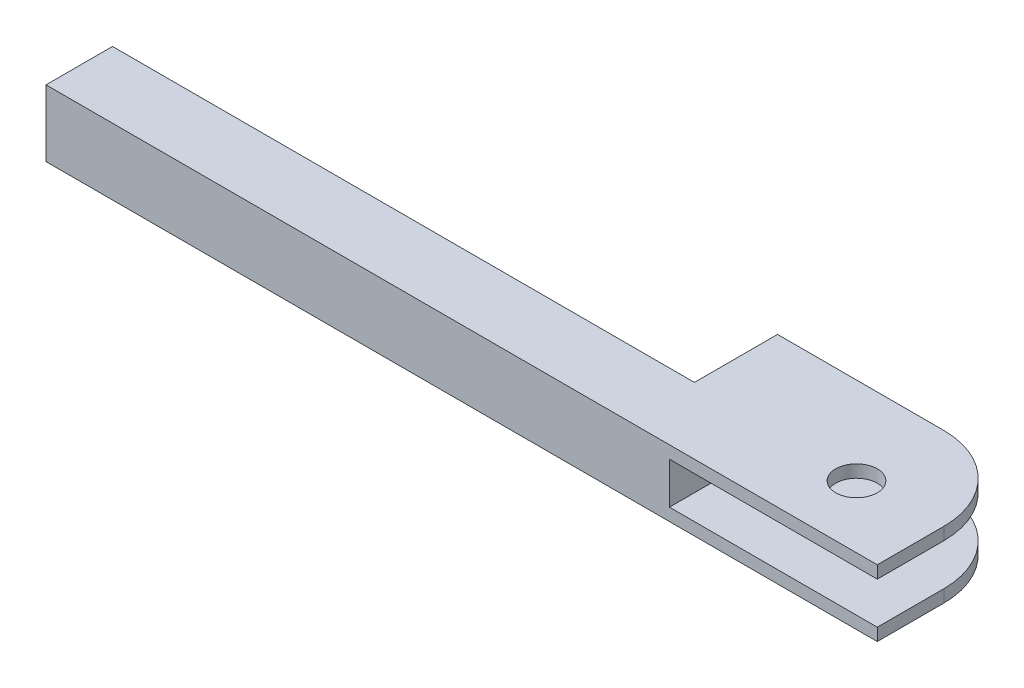
from build123d import *

# Parameters (mm, degrees)
BOSS_EXTRUDE1_DEPTH = 8
SKETCH2_W           = 25
SKETCH2_H           = 5
CUT_EXTRUDE1_DEPTH  = 35
SKETCH3_R           = 2.5
CUT_EXTRUDE2_DEPTH  = 35
FILLET1_R           = 10


with BuildPart() as part:
    # Sketch1 → Boss-Extrude1 (new body)
    with BuildSketch(Plane(origin=(0, 0, 0), x_dir=(1, 0, 0), z_dir=(0, 1, 0))):
        Polygon((0, 0), (0, 8), (70, 8), (70, 18), (100, 18), (100, 0), align=None)
    extrude(amount=BOSS_EXTRUDE1_DEPTH)

    # Sketch2 → Cut-Extrude1 (cut)
    with BuildSketch(Plane.XY):
        with Locations((87.5, 4)):
            Rectangle(SKETCH2_W, SKETCH2_H)
    extrude(amount=-CUT_EXTRUDE1_DEPTH, mode=Mode.SUBTRACT)

    # Sketch3 → Cut-Extrude2 (cut)
    with BuildSketch(Plane(origin=(0, 8, 0), x_dir=(1, 0, 0), z_dir=(0, 1, 0))):
        with Locations(Location((90, 7.5, 0), (0, 0, 270))):
            Circle(SKETCH3_R)
    extrude(amount=-CUT_EXTRUDE2_DEPTH, mode=Mode.SUBTRACT)

    # Fillet1
    fillet1_edges = [part.edges().sort_by_distance(p)[0] for p in [
        (100, 7.25, -18),
        (100, 0.75, -18),
    ]]
    fillet(fillet1_edges, radius=FILLET1_R)


solid = part.part
